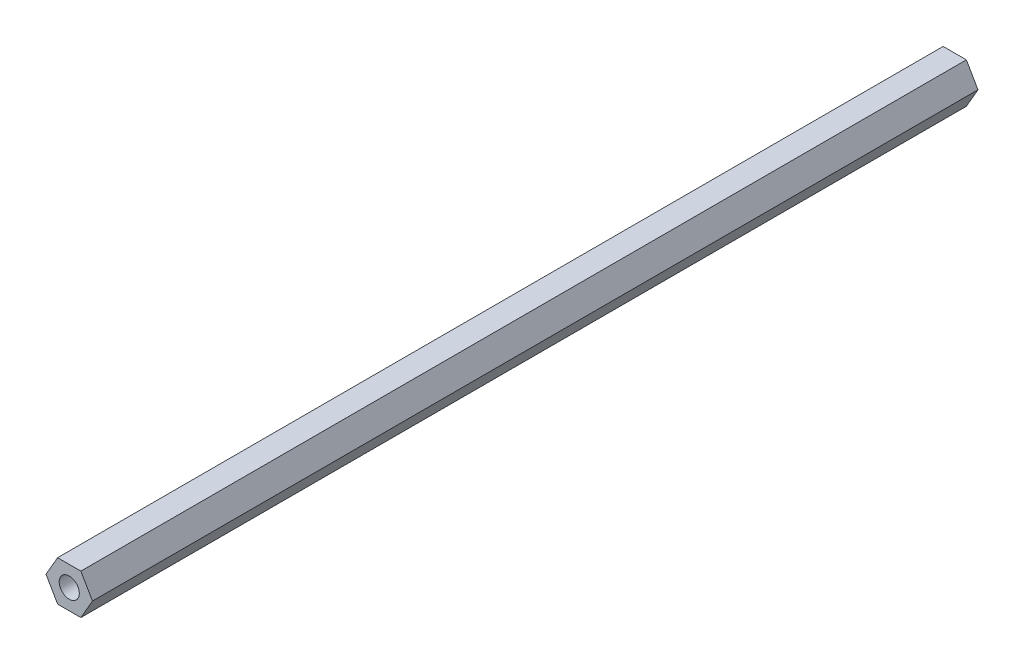
from build123d import *

# Parameters (mm, degrees)
SKETCH1_R           = 3.175
BOSS_EXTRUDE1_DEPTH = 279.4


with BuildPart() as part:
    # Sketch1 → Boss-Extrude1 (new body)
    with BuildSketch(Plane.XY):
        Polygon((-7.332348419, 0), (-3.666174209, -6.35), (3.666174209, -6.35), (7.332348419, 0), (3.666174209, 6.35), (-3.666174209, 6.35), align=None)
        Circle(SKETCH1_R, mode=Mode.SUBTRACT)
    extrude(amount=BOSS_EXTRUDE1_DEPTH)


solid = part.part
